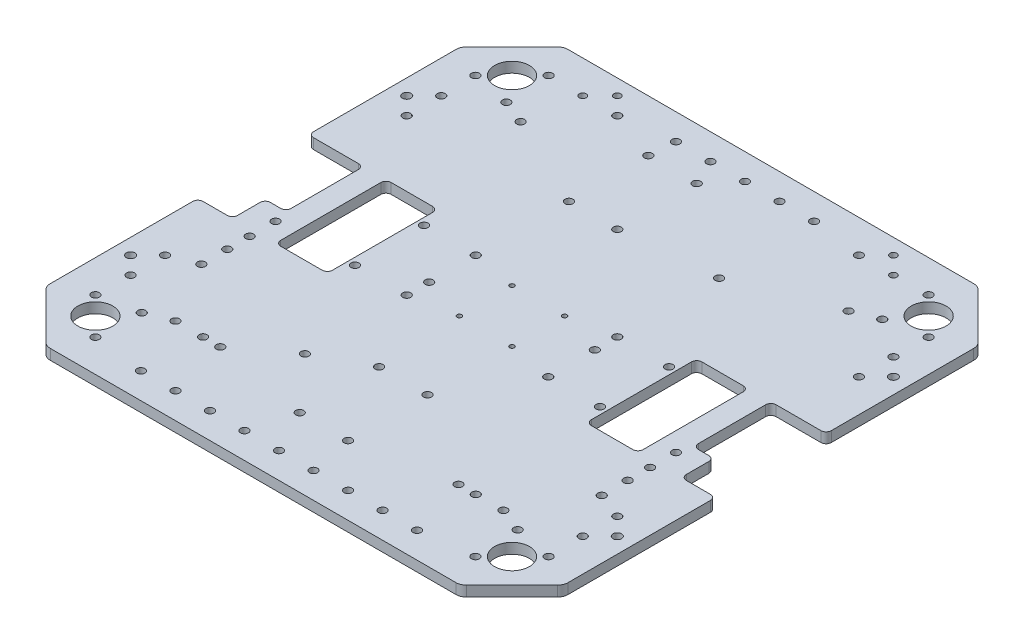
from build123d import *

# Parameters (mm, degrees)
BOSS_EXTRU_1_DEPTH                  = 6
ENL_V_MAT_EXTRU_1_REACH             = 214.217
ESQUISSE2_R                         = 10.1
ESQUISSE2_R_2                       = 2.3
SYM_TRIE2_COPY_1_REACH              = 214.217
SYM_TRIE2_COPY_1_SKETCH_R           = 10.1
SYM_TRIE2_COPY_1_SKETCH_R_2         = 2.3
ENL_V_MAT_EXTRU_2_REACH             = 214.217
ENL_V_MAT_EXTRU_2_DIRECTION_2_DEPTH = 213.216870206
CONG_1_R                            = 3
ENL_V_MAT_EXTRU_3_REACH             = 214.217
CONG_2_R                            = 3
ENL_V_MAT_EXTRU_4_REACH             = 214.217
ESQUISSE5_R                         = 2.3
ENL_V_MAT_EXTRU_5_REACH             = 214.217
ESQUISSE6_R                         = 2.3
ENL_V_MAT_EXTRU_6_REACH             = 214.217
ESQUISSE7_R                         = 2.476946043
ESQUISSE7_R_2                       = 2.3
ENL_V_MAT_EXTRU_7_REACH             = 214.217
ESQUISSE8_R                         = 2.3
ENL_V_MAT_EXTRU_8_REACH             = 214.217
ESQUISSE10_R                        = 2.3
CONG_3_R                            = 6
ENL_V_MAT_EXTRU_9_REACH             = 214.217
ESQUISSE11_R                        = 2.3
ENL_V_MAT_EXTRU_10_REACH            = 214.217
ESQUISSE12_R                        = 2.3
ENL_V_MAT_EXTRU_11_REACH            = 214.217
ESQUISSE13_R                        = 2.3
ENL_V_MAT_EXTRU_12_REACH            = 214.217
ESQUISSE14_R                        = 2.3
ESQUISSE14_R_2                      = 2
ENL_V_MAT_EXTRU_13_REACH            = 214.217
ESQUISSE15_W                        = 15
ESQUISSE15_H                        = 45
CONG_4_R                            = 3
ESQUISSE16_R                        = 1.35
ENL_V_MAT_EXTRU_14_DEPTH            = 10
ESQUISSE17_R                        = 2.3
ENL_V_MAT_EXTRU_16_DEPTH            = 10


with BuildPart() as part:
    # Esquisse1 → Boss.-Extru.1 (new body)
    with BuildSketch(Plane(origin=(0, 0, 0), x_dir=(1, 0, 0), z_dir=(0, 1, 0))):
        Polygon((-150, 0), (-150, 120), (-120, 150), (0, 150), (120, 150), (150, 120), (150, 0), (150, -120), (120, -150), (0, -150), (-120, -150), (-150, -120), align=None)
    extrude(amount=BOSS_EXTRU_1_DEPTH)

    # Esquisse2 → Enlèv. mat.-Extru.1 (cut, up to next)
    with BuildSketch(Plane(origin=(0, 6, 0), x_dir=(1, 0, 0), z_dir=(0, 1, 0)), mode=Mode.PRIVATE) as enl_v_mat_extru_1_sk1:
        with Locations(Location((-120.69746073, 120.69746073, 0), (0, 0, 270))):
            Circle(ESQUISSE2_R)
    enl_v_mat_extru_1_tool1 = extrude(enl_v_mat_extru_1_sk1.sketch, amount=-ENL_V_MAT_EXTRU_1_REACH, mode=Mode.PRIVATE) & part.part
    # Esquisse2 → Enlèv. mat.-Extru.1 (cut, up to next)
    with BuildSketch(Plane(origin=(0, 6, 0), x_dir=(1, 0, 0), z_dir=(0, 1, 0)), mode=Mode.PRIVATE) as enl_v_mat_extru_1_sk2:
        with Locations(Location((-131.304062448, 110.090859012, 0), (0, 0, 270))):
            Circle(ESQUISSE2_R_2)
    enl_v_mat_extru_1_tool2 = extrude(enl_v_mat_extru_1_sk2.sketch, amount=-ENL_V_MAT_EXTRU_1_REACH, mode=Mode.PRIVATE) & part.part
    # Esquisse2 → Enlèv. mat.-Extru.1 (cut, up to next)
    with BuildSketch(Plane(origin=(0, 6, 0), x_dir=(1, 0, 0), z_dir=(0, 1, 0)), mode=Mode.PRIVATE) as enl_v_mat_extru_1_sk3:
        with Locations(Location((-110.090859012, 131.304062448, 0), (0, 0, 270))):
            Circle(ESQUISSE2_R_2)
    enl_v_mat_extru_1_tool3 = extrude(enl_v_mat_extru_1_sk3.sketch, amount=-ENL_V_MAT_EXTRU_1_REACH, mode=Mode.PRIVATE) & part.part
    enl_v_mat_extru_1_1 = enl_v_mat_extru_1_tool1.solids().sort_by_distance((-120.697461, 6, -120.697461))[0]
    add(enl_v_mat_extru_1_1, mode=Mode.SUBTRACT)
    enl_v_mat_extru_1_2 = enl_v_mat_extru_1_tool2.solids().sort_by_distance((-131.304062, 6, -110.090859))[0]
    add(enl_v_mat_extru_1_2, mode=Mode.SUBTRACT)
    enl_v_mat_extru_1_3 = enl_v_mat_extru_1_tool3.solids().sort_by_distance((-110.090859, 6, -131.304062))[0]
    add(enl_v_mat_extru_1_3, mode=Mode.SUBTRACT)
    enl_v_mat_extru_1 = enl_v_mat_extru_1_1 + enl_v_mat_extru_1_2 + enl_v_mat_extru_1_3  # Enlèv. mat.-Extru.1 as one shape, for the pattern or mirror that repeats it

    # Symétrie1: Enlèv. mat.-Extru.1 across plane
    add(enl_v_mat_extru_1.mirror(Plane(origin=(0, 0, 0), x_dir=(0, 0, 1), z_dir=(1, 0, 0))), mode=Mode.SUBTRACT)

    # Symétrie2: Enlèv. mat.-Extru.1 across plane
    add(enl_v_mat_extru_1.mirror(Plane.XY), mode=Mode.SUBTRACT)

    # Symétrie2 copy 1 sketch → Symétrie2 copy 1 (cut, up to next)
    with BuildSketch(Plane(origin=(0, 6, 0), x_dir=(-1, 0, 0), z_dir=(0, 1, 0)), mode=Mode.PRIVATE) as sym_trie2_copy_1_sk1:
        with Locations(Location((-120.69746073, 120.69746073, 0), (0, 0, 270))):
            Circle(SYM_TRIE2_COPY_1_SKETCH_R)
    sym_trie2_copy_1_tool1 = extrude(sym_trie2_copy_1_sk1.sketch, amount=-SYM_TRIE2_COPY_1_REACH, mode=Mode.PRIVATE) & part.part
    # Symétrie2 copy 1 sketch → Symétrie2 copy 1 (cut, up to next)
    with BuildSketch(Plane(origin=(0, 6, 0), x_dir=(-1, 0, 0), z_dir=(0, 1, 0)), mode=Mode.PRIVATE) as sym_trie2_copy_1_sk2:
        with Locations(Location((-131.304062448, 110.090859012, 0), (0, 0, 270))):
            Circle(SYM_TRIE2_COPY_1_SKETCH_R_2)
    sym_trie2_copy_1_tool2 = extrude(sym_trie2_copy_1_sk2.sketch, amount=-SYM_TRIE2_COPY_1_REACH, mode=Mode.PRIVATE) & part.part
    # Symétrie2 copy 1 sketch → Symétrie2 copy 1 (cut, up to next)
    with BuildSketch(Plane(origin=(0, 6, 0), x_dir=(-1, 0, 0), z_dir=(0, 1, 0)), mode=Mode.PRIVATE) as sym_trie2_copy_1_sk3:
        with Locations(Location((-110.090859012, 131.304062448, 0), (0, 0, 270))):
            Circle(SYM_TRIE2_COPY_1_SKETCH_R_2)
    sym_trie2_copy_1_tool3 = extrude(sym_trie2_copy_1_sk3.sketch, amount=-SYM_TRIE2_COPY_1_REACH, mode=Mode.PRIVATE) & part.part
    add(sym_trie2_copy_1_tool1.solids().sort_by_distance((120.697461, 6, 120.697461))[0], mode=Mode.SUBTRACT)
    add(sym_trie2_copy_1_tool2.solids().sort_by_distance((131.304062, 6, 110.090859))[0], mode=Mode.SUBTRACT)
    add(sym_trie2_copy_1_tool3.solids().sort_by_distance((110.090859, 6, 131.304062))[0], mode=Mode.SUBTRACT)

    # Esquisse3 → Enlèv. mat.-Extru.2 (cut, up to next)
    with BuildSketch(Plane(origin=(0, 6, 0), x_dir=(1, 0, 0), z_dir=(0, 1, 0)), mode=Mode.PRIVATE) as enl_v_mat_extru_2_sk1:
        Polygon((-150, 0), (-150, -32), (-130, -32), (-130, 32), (-150, 32), align=None)
    enl_v_mat_extru_2_tool1 = extrude(enl_v_mat_extru_2_sk1.sketch, amount=-ENL_V_MAT_EXTRU_2_REACH, mode=Mode.PRIVATE) & part.part
    enl_v_mat_extru_2 = enl_v_mat_extru_2_tool1.solids().sort_by_distance((-140, 6, 0))[0]
    add(enl_v_mat_extru_2, mode=Mode.SUBTRACT)

    # Esquisse3 → Enlèv. mat.-Extru.2 direction 2 (cut)
    with BuildSketch(Plane(origin=(0, 6, 0), x_dir=(1, 0, 0), z_dir=(0, 1, 0))):
        Polygon((-150, 0), (-150, -32), (-130, -32), (-130, 32), (-150, 32), align=None)
    enl_v_mat_extru_2_direction_2 = extrude(amount=ENL_V_MAT_EXTRU_2_DIRECTION_2_DEPTH, mode=Mode.SUBTRACT)

    # Symétrie3: Enlèv. mat.-Extru.2, Enlèv. mat.-Extru.2 direction 2 across plane
    add(enl_v_mat_extru_2.mirror(Plane(origin=(0, 0, 0), x_dir=(0, 0, 1), z_dir=(1, 0, 0))), mode=Mode.SUBTRACT)
    add(enl_v_mat_extru_2_direction_2.mirror(Plane(origin=(0, 0, 0), x_dir=(0, 0, 1), z_dir=(1, 0, 0))), mode=Mode.SUBTRACT)

    # Congé1
    cong_1_edges = [part.edges().sort_by_distance(p)[0] for p in [
        (150, 3, 32),
        (150, 3, -32),
        (130, 3, -32),
        (130, 3, 32),
        (-150, 3, -32),
        (-150, 3, 32),
        (-130, 3, 32),
        (-130, 3, -32),
    ]]
    fillet(cong_1_edges, radius=CONG_1_R)

    # Esquisse4 → Enlèv. mat.-Extru.3 (cut, up to next)
    with BuildSketch(Plane(origin=(0, 6, 0), x_dir=(1, 0, 0), z_dir=(0, 1, 0)), mode=Mode.PRIVATE) as enl_v_mat_extru_3_sk1:
        Polygon((-105, 0), (-105, 32), (-75, 32), (-75, -32), (-105, -32), align=None)
    enl_v_mat_extru_3_tool1 = extrude(enl_v_mat_extru_3_sk1.sketch, amount=-ENL_V_MAT_EXTRU_3_REACH, mode=Mode.PRIVATE) & part.part
    enl_v_mat_extru_3 = enl_v_mat_extru_3_tool1.solids().sort_by_distance((-90, 6, 0))[0]
    add(enl_v_mat_extru_3, mode=Mode.SUBTRACT)

    # Symétrie4: Enlèv. mat.-Extru.3 across plane
    add(enl_v_mat_extru_3.mirror(Plane(origin=(0, 0, 0), x_dir=(0, 0, 1), z_dir=(1, 0, 0))), mode=Mode.SUBTRACT)

    # Congé2
    cong_2_edges = [part.edges().sort_by_distance(p)[0] for p in [
        (-105, 3, -32),
        (-75, 3, -32),
        (-75, 3, 32),
        (-105, 3, 32),
        (75, 3, -32),
        (105, 3, -32),
        (105, 3, 32),
        (75, 3, 32),
    ]]
    fillet(cong_2_edges, radius=CONG_2_R)

    # Esquisse5 → Enlèv. mat.-Extru.4 (cut, up to next)
    with BuildSketch(Plane(origin=(0, 6, 0), x_dir=(1, 0, 0), z_dir=(0, 1, 0)), mode=Mode.PRIVATE) as enl_v_mat_extru_4_sk1:
        with Locations(Location((-71, 20, 0), (0, 0, 270))):
            Circle(ESQUISSE5_R)
    enl_v_mat_extru_4_tool1 = extrude(enl_v_mat_extru_4_sk1.sketch, amount=-ENL_V_MAT_EXTRU_4_REACH, mode=Mode.PRIVATE) & part.part
    # Esquisse5 → Enlèv. mat.-Extru.4 (cut, up to next)
    with BuildSketch(Plane(origin=(0, 6, 0), x_dir=(1, 0, 0), z_dir=(0, 1, 0)), mode=Mode.PRIVATE) as enl_v_mat_extru_4_sk2:
        with Locations(Location((-71, -20, 0), (0, 0, 270))):
            Circle(ESQUISSE5_R)
    enl_v_mat_extru_4_tool2 = extrude(enl_v_mat_extru_4_sk2.sketch, amount=-ENL_V_MAT_EXTRU_4_REACH, mode=Mode.PRIVATE) & part.part
    enl_v_mat_extru_4_1 = enl_v_mat_extru_4_tool1.solids().sort_by_distance((-71, 6, -20))[0]
    add(enl_v_mat_extru_4_1, mode=Mode.SUBTRACT)
    enl_v_mat_extru_4_2 = enl_v_mat_extru_4_tool2.solids().sort_by_distance((-71, 6, 20))[0]
    add(enl_v_mat_extru_4_2, mode=Mode.SUBTRACT)
    enl_v_mat_extru_4 = enl_v_mat_extru_4_1 + enl_v_mat_extru_4_2  # Enlèv. mat.-Extru.4 as one shape, for the pattern or mirror that repeats it

    # Symétrie5: Enlèv. mat.-Extru.4 across plane
    add(enl_v_mat_extru_4.mirror(Plane(origin=(0, 0, 0), x_dir=(0, 0, 1), z_dir=(1, 0, 0))), mode=Mode.SUBTRACT)

    # Esquisse6 → Enlèv. mat.-Extru.5 (cut, up to next)
    with BuildSketch(Plane(origin=(0, 6, 0), x_dir=(1, 0, 0), z_dir=(0, 1, 0)), mode=Mode.PRIVATE) as enl_v_mat_extru_5_sk1:
        with Locations(Location((-41, -79, 0), (0, 0, 270))):
            Circle(ESQUISSE6_R)
    enl_v_mat_extru_5_tool1 = extrude(enl_v_mat_extru_5_sk1.sketch, amount=-ENL_V_MAT_EXTRU_5_REACH, mode=Mode.PRIVATE) & part.part
    # Esquisse6 → Enlèv. mat.-Extru.5 (cut, up to next)
    with BuildSketch(Plane(origin=(0, 6, 0), x_dir=(1, 0, 0), z_dir=(0, 1, 0)), mode=Mode.PRIVATE) as enl_v_mat_extru_5_sk2:
        with Locations(Location((-41, -20, 0), (0, 0, 270))):
            Circle(ESQUISSE6_R)
    enl_v_mat_extru_5_tool2 = extrude(enl_v_mat_extru_5_sk2.sketch, amount=-ENL_V_MAT_EXTRU_5_REACH, mode=Mode.PRIVATE) & part.part
    # Esquisse6 → Enlèv. mat.-Extru.5 (cut, up to next)
    with BuildSketch(Plane(origin=(0, 6, 0), x_dir=(1, 0, 0), z_dir=(0, 1, 0)), mode=Mode.PRIVATE) as enl_v_mat_extru_5_sk3:
        with Locations(Location((-41, 20, 0), (0, 0, 270))):
            Circle(ESQUISSE6_R)
    enl_v_mat_extru_5_tool3 = extrude(enl_v_mat_extru_5_sk3.sketch, amount=-ENL_V_MAT_EXTRU_5_REACH, mode=Mode.PRIVATE) & part.part
    # Esquisse6 → Enlèv. mat.-Extru.5 (cut, up to next)
    with BuildSketch(Plane(origin=(0, 6, 0), x_dir=(1, 0, 0), z_dir=(0, 1, 0)), mode=Mode.PRIVATE) as enl_v_mat_extru_5_sk4:
        with Locations(Location((41, -20, 0), (0, 0, 270))):
            Circle(ESQUISSE6_R)
    enl_v_mat_extru_5_tool4 = extrude(enl_v_mat_extru_5_sk4.sketch, amount=-ENL_V_MAT_EXTRU_5_REACH, mode=Mode.PRIVATE) & part.part
    # Esquisse6 → Enlèv. mat.-Extru.5 (cut, up to next)
    with BuildSketch(Plane(origin=(0, 6, 0), x_dir=(1, 0, 0), z_dir=(0, 1, 0)), mode=Mode.PRIVATE) as enl_v_mat_extru_5_sk5:
        with Locations(Location((41, 79, 0), (0, 0, 270))):
            Circle(ESQUISSE6_R)
    enl_v_mat_extru_5_tool5 = extrude(enl_v_mat_extru_5_sk5.sketch, amount=-ENL_V_MAT_EXTRU_5_REACH, mode=Mode.PRIVATE) & part.part
    # Esquisse6 → Enlèv. mat.-Extru.5 (cut, up to next)
    with BuildSketch(Plane(origin=(0, 6, 0), x_dir=(1, 0, 0), z_dir=(0, 1, 0)), mode=Mode.PRIVATE) as enl_v_mat_extru_5_sk6:
        with Locations(Location((41, 20, 0), (0, 0, 270))):
            Circle(ESQUISSE6_R)
    enl_v_mat_extru_5_tool6 = extrude(enl_v_mat_extru_5_sk6.sketch, amount=-ENL_V_MAT_EXTRU_5_REACH, mode=Mode.PRIVATE) & part.part
    # Esquisse6 → Enlèv. mat.-Extru.5 (cut, up to next)
    with BuildSketch(Plane(origin=(0, 6, 0), x_dir=(1, 0, 0), z_dir=(0, 1, 0)), mode=Mode.PRIVATE) as enl_v_mat_extru_5_sk7:
        with Locations(Location((41, 7, 0), (0, 0, 270))):
            Circle(ESQUISSE6_R)
    enl_v_mat_extru_5_tool7 = extrude(enl_v_mat_extru_5_sk7.sketch, amount=-ENL_V_MAT_EXTRU_5_REACH, mode=Mode.PRIVATE) & part.part
    # Esquisse6 → Enlèv. mat.-Extru.5 (cut, up to next)
    with BuildSketch(Plane(origin=(0, 6, 0), x_dir=(1, 0, 0), z_dir=(0, 1, 0)), mode=Mode.PRIVATE) as enl_v_mat_extru_5_sk8:
        with Locations(Location((-41, -7, 0), (0, 0, 270))):
            Circle(ESQUISSE6_R)
    enl_v_mat_extru_5_tool8 = extrude(enl_v_mat_extru_5_sk8.sketch, amount=-ENL_V_MAT_EXTRU_5_REACH, mode=Mode.PRIVATE) & part.part
    add(enl_v_mat_extru_5_tool1.solids().sort_by_distance((-41, 6, 79))[0], mode=Mode.SUBTRACT)
    add(enl_v_mat_extru_5_tool2.solids().sort_by_distance((-41, 6, 20))[0], mode=Mode.SUBTRACT)
    add(enl_v_mat_extru_5_tool3.solids().sort_by_distance((-41, 6, -20))[0], mode=Mode.SUBTRACT)
    add(enl_v_mat_extru_5_tool4.solids().sort_by_distance((41, 6, 20))[0], mode=Mode.SUBTRACT)
    add(enl_v_mat_extru_5_tool5.solids().sort_by_distance((41, 6, -79))[0], mode=Mode.SUBTRACT)
    add(enl_v_mat_extru_5_tool6.solids().sort_by_distance((41, 6, -20))[0], mode=Mode.SUBTRACT)
    add(enl_v_mat_extru_5_tool7.solids().sort_by_distance((41, 6, -7))[0], mode=Mode.SUBTRACT)
    add(enl_v_mat_extru_5_tool8.solids().sort_by_distance((-41, 6, 7))[0], mode=Mode.SUBTRACT)

    # Esquisse7 → Enlèv. mat.-Extru.6 (cut, up to next)
    with BuildSketch(Plane(origin=(0, 6, 0), x_dir=(1, 0, 0), z_dir=(0, 1, 0)), mode=Mode.PRIVATE) as enl_v_mat_extru_6_sk1:
        with Locations(Location((141, -80, 0), (0, 0, 270))):
            Circle(ESQUISSE7_R)
    enl_v_mat_extru_6_tool1 = extrude(enl_v_mat_extru_6_sk1.sketch, amount=-ENL_V_MAT_EXTRU_6_REACH, mode=Mode.PRIVATE) & part.part
    # Esquisse7 → Enlèv. mat.-Extru.6 (cut, up to next)
    with BuildSketch(Plane(origin=(0, 6, 0), x_dir=(1, 0, 0), z_dir=(0, 1, 0)), mode=Mode.PRIVATE) as enl_v_mat_extru_6_sk2:
        with Locations(Location((131, -90, 0), (0, 0, 270))):
            Circle(ESQUISSE7_R_2)
    enl_v_mat_extru_6_tool2 = extrude(enl_v_mat_extru_6_sk2.sketch, amount=-ENL_V_MAT_EXTRU_6_REACH, mode=Mode.PRIVATE) & part.part
    # Esquisse7 → Enlèv. mat.-Extru.6 (cut, up to next)
    with BuildSketch(Plane(origin=(0, 6, 0), x_dir=(1, 0, 0), z_dir=(0, 1, 0)), mode=Mode.PRIVATE) as enl_v_mat_extru_6_sk3:
        with Locations(Location((131, -70, 0), (0, 0, 270))):
            Circle(ESQUISSE7_R_2)
    enl_v_mat_extru_6_tool3 = extrude(enl_v_mat_extru_6_sk3.sketch, amount=-ENL_V_MAT_EXTRU_6_REACH, mode=Mode.PRIVATE) & part.part
    # Esquisse7 → Enlèv. mat.-Extru.6 (cut, up to next)
    with BuildSketch(Plane(origin=(0, 6, 0), x_dir=(1, 0, 0), z_dir=(0, 1, 0)), mode=Mode.PRIVATE) as enl_v_mat_extru_6_sk4:
        with Locations(Location((131, 70, 0), (0, 0, 270))):
            Circle(ESQUISSE7_R_2)
    enl_v_mat_extru_6_tool4 = extrude(enl_v_mat_extru_6_sk4.sketch, amount=-ENL_V_MAT_EXTRU_6_REACH, mode=Mode.PRIVATE) & part.part
    # Esquisse7 → Enlèv. mat.-Extru.6 (cut, up to next)
    with BuildSketch(Plane(origin=(0, 6, 0), x_dir=(1, 0, 0), z_dir=(0, 1, 0)), mode=Mode.PRIVATE) as enl_v_mat_extru_6_sk5:
        with Locations(Location((131, 90, 0), (0, 0, 270))):
            Circle(ESQUISSE7_R_2)
    enl_v_mat_extru_6_tool5 = extrude(enl_v_mat_extru_6_sk5.sketch, amount=-ENL_V_MAT_EXTRU_6_REACH, mode=Mode.PRIVATE) & part.part
    # Esquisse7 → Enlèv. mat.-Extru.6 (cut, up to next)
    with BuildSketch(Plane(origin=(0, 6, 0), x_dir=(1, 0, 0), z_dir=(0, 1, 0)), mode=Mode.PRIVATE) as enl_v_mat_extru_6_sk6:
        with Locations(Location((141, 80, 0), (0, 0, 270))):
            Circle(ESQUISSE7_R)
    enl_v_mat_extru_6_tool6 = extrude(enl_v_mat_extru_6_sk6.sketch, amount=-ENL_V_MAT_EXTRU_6_REACH, mode=Mode.PRIVATE) & part.part
    enl_v_mat_extru_6_1 = enl_v_mat_extru_6_tool1.solids().sort_by_distance((141, 6, 80))[0]
    add(enl_v_mat_extru_6_1, mode=Mode.SUBTRACT)
    enl_v_mat_extru_6_2 = enl_v_mat_extru_6_tool2.solids().sort_by_distance((131, 6, 90))[0]
    add(enl_v_mat_extru_6_2, mode=Mode.SUBTRACT)
    enl_v_mat_extru_6_3 = enl_v_mat_extru_6_tool3.solids().sort_by_distance((131, 6, 70))[0]
    add(enl_v_mat_extru_6_3, mode=Mode.SUBTRACT)
    enl_v_mat_extru_6_4 = enl_v_mat_extru_6_tool4.solids().sort_by_distance((131, 6, -70))[0]
    add(enl_v_mat_extru_6_4, mode=Mode.SUBTRACT)
    enl_v_mat_extru_6_5 = enl_v_mat_extru_6_tool5.solids().sort_by_distance((131, 6, -90))[0]
    add(enl_v_mat_extru_6_5, mode=Mode.SUBTRACT)
    enl_v_mat_extru_6_6 = enl_v_mat_extru_6_tool6.solids().sort_by_distance((141, 6, -80))[0]
    add(enl_v_mat_extru_6_6, mode=Mode.SUBTRACT)
    enl_v_mat_extru_6 = enl_v_mat_extru_6_1 + enl_v_mat_extru_6_2 + enl_v_mat_extru_6_3 + enl_v_mat_extru_6_4 + enl_v_mat_extru_6_5 + enl_v_mat_extru_6_6  # Enlèv. mat.-Extru.6 as one shape, for the pattern or mirror that repeats it

    # Symétrie6: Enlèv. mat.-Extru.6 across plane
    add(enl_v_mat_extru_6.mirror(Plane(origin=(0, 0, 0), x_dir=(0, 0, 1), z_dir=(1, 0, 0))), mode=Mode.SUBTRACT)

    # Esquisse8 → Enlèv. mat.-Extru.7 (cut, up to next)
    with BuildSketch(Plane(origin=(0, 6, 0), x_dir=(1, 0, 0), z_dir=(0, 1, 0)), mode=Mode.PRIVATE) as enl_v_mat_extru_7_sk1:
        with Locations(Location((-80, -135, 0), (0, 0, 270))):
            Circle(ESQUISSE8_R)
    enl_v_mat_extru_7_tool1 = extrude(enl_v_mat_extru_7_sk1.sketch, amount=-ENL_V_MAT_EXTRU_7_REACH, mode=Mode.PRIVATE) & part.part
    # Esquisse8 → Enlèv. mat.-Extru.7 (cut, up to next)
    with BuildSketch(Plane(origin=(0, 6, 0), x_dir=(1, 0, 0), z_dir=(0, 1, 0)), mode=Mode.PRIVATE) as enl_v_mat_extru_7_sk2:
        with Locations(Location((80, -135, 0), (0, 0, 270))):
            Circle(ESQUISSE8_R)
    enl_v_mat_extru_7_tool2 = extrude(enl_v_mat_extru_7_sk2.sketch, amount=-ENL_V_MAT_EXTRU_7_REACH, mode=Mode.PRIVATE) & part.part
    # Esquisse8 → Enlèv. mat.-Extru.7 (cut, up to next)
    with BuildSketch(Plane(origin=(0, 6, 0), x_dir=(1, 0, 0), z_dir=(0, 1, 0)), mode=Mode.PRIVATE) as enl_v_mat_extru_7_sk3:
        with Locations(Location((-60, -135, 0), (0, 0, 270))):
            Circle(ESQUISSE8_R)
    enl_v_mat_extru_7_tool3 = extrude(enl_v_mat_extru_7_sk3.sketch, amount=-ENL_V_MAT_EXTRU_7_REACH, mode=Mode.PRIVATE) & part.part
    # Esquisse8 → Enlèv. mat.-Extru.7 (cut, up to next)
    with BuildSketch(Plane(origin=(0, 6, 0), x_dir=(1, 0, 0), z_dir=(0, 1, 0)), mode=Mode.PRIVATE) as enl_v_mat_extru_7_sk4:
        with Locations(Location((-40, -135, 0), (0, 0, 270))):
            Circle(ESQUISSE8_R)
    enl_v_mat_extru_7_tool4 = extrude(enl_v_mat_extru_7_sk4.sketch, amount=-ENL_V_MAT_EXTRU_7_REACH, mode=Mode.PRIVATE) & part.part
    # Esquisse8 → Enlèv. mat.-Extru.7 (cut, up to next)
    with BuildSketch(Plane(origin=(0, 6, 0), x_dir=(1, 0, 0), z_dir=(0, 1, 0)), mode=Mode.PRIVATE) as enl_v_mat_extru_7_sk5:
        with Locations(Location((-20, -135, 0), (0, 0, 270))):
            Circle(ESQUISSE8_R)
    enl_v_mat_extru_7_tool5 = extrude(enl_v_mat_extru_7_sk5.sketch, amount=-ENL_V_MAT_EXTRU_7_REACH, mode=Mode.PRIVATE) & part.part
    # Esquisse8 → Enlèv. mat.-Extru.7 (cut, up to next)
    with BuildSketch(Plane(origin=(0, 6, 0), x_dir=(1, 0, 0), z_dir=(0, 1, 0)), mode=Mode.PRIVATE) as enl_v_mat_extru_7_sk6:
        with Locations(Location((0, -135, 0), (0, 0, 270))):
            Circle(ESQUISSE8_R)
    enl_v_mat_extru_7_tool6 = extrude(enl_v_mat_extru_7_sk6.sketch, amount=-ENL_V_MAT_EXTRU_7_REACH, mode=Mode.PRIVATE) & part.part
    # Esquisse8 → Enlèv. mat.-Extru.7 (cut, up to next)
    with BuildSketch(Plane(origin=(0, 6, 0), x_dir=(1, 0, 0), z_dir=(0, 1, 0)), mode=Mode.PRIVATE) as enl_v_mat_extru_7_sk7:
        with Locations(Location((20, -135, 0), (0, 0, 270))):
            Circle(ESQUISSE8_R)
    enl_v_mat_extru_7_tool7 = extrude(enl_v_mat_extru_7_sk7.sketch, amount=-ENL_V_MAT_EXTRU_7_REACH, mode=Mode.PRIVATE) & part.part
    # Esquisse8 → Enlèv. mat.-Extru.7 (cut, up to next)
    with BuildSketch(Plane(origin=(0, 6, 0), x_dir=(1, 0, 0), z_dir=(0, 1, 0)), mode=Mode.PRIVATE) as enl_v_mat_extru_7_sk8:
        with Locations(Location((40, -135, 0), (0, 0, 270))):
            Circle(ESQUISSE8_R)
    enl_v_mat_extru_7_tool8 = extrude(enl_v_mat_extru_7_sk8.sketch, amount=-ENL_V_MAT_EXTRU_7_REACH, mode=Mode.PRIVATE) & part.part
    # Esquisse8 → Enlèv. mat.-Extru.7 (cut, up to next)
    with BuildSketch(Plane(origin=(0, 6, 0), x_dir=(1, 0, 0), z_dir=(0, 1, 0)), mode=Mode.PRIVATE) as enl_v_mat_extru_7_sk9:
        with Locations(Location((60, -135, 0), (0, 0, 270))):
            Circle(ESQUISSE8_R)
    enl_v_mat_extru_7_tool9 = extrude(enl_v_mat_extru_7_sk9.sketch, amount=-ENL_V_MAT_EXTRU_7_REACH, mode=Mode.PRIVATE) & part.part
    # Esquisse8 → Enlèv. mat.-Extru.7 (cut, up to next)
    with BuildSketch(Plane(origin=(0, 6, 0), x_dir=(1, 0, 0), z_dir=(0, 1, 0)), mode=Mode.PRIVATE) as enl_v_mat_extru_7_sk10:
        with Locations(Location((40, 135, 0), (0, 0, 270))):
            Circle(ESQUISSE8_R)
    enl_v_mat_extru_7_tool10 = extrude(enl_v_mat_extru_7_sk10.sketch, amount=-ENL_V_MAT_EXTRU_7_REACH, mode=Mode.PRIVATE) & part.part
    # Esquisse8 → Enlèv. mat.-Extru.7 (cut, up to next)
    with BuildSketch(Plane(origin=(0, 6, 0), x_dir=(1, 0, 0), z_dir=(0, 1, 0)), mode=Mode.PRIVATE) as enl_v_mat_extru_7_sk11:
        with Locations(Location((20, 135, 0), (0, 0, 270))):
            Circle(ESQUISSE8_R)
    enl_v_mat_extru_7_tool11 = extrude(enl_v_mat_extru_7_sk11.sketch, amount=-ENL_V_MAT_EXTRU_7_REACH, mode=Mode.PRIVATE) & part.part
    # Esquisse8 → Enlèv. mat.-Extru.7 (cut, up to next)
    with BuildSketch(Plane(origin=(0, 6, 0), x_dir=(1, 0, 0), z_dir=(0, 1, 0)), mode=Mode.PRIVATE) as enl_v_mat_extru_7_sk12:
        with Locations(Location((0, 135, 0), (0, 0, 270))):
            Circle(ESQUISSE8_R)
    enl_v_mat_extru_7_tool12 = extrude(enl_v_mat_extru_7_sk12.sketch, amount=-ENL_V_MAT_EXTRU_7_REACH, mode=Mode.PRIVATE) & part.part
    # Esquisse8 → Enlèv. mat.-Extru.7 (cut, up to next)
    with BuildSketch(Plane(origin=(0, 6, 0), x_dir=(1, 0, 0), z_dir=(0, 1, 0)), mode=Mode.PRIVATE) as enl_v_mat_extru_7_sk13:
        with Locations(Location((-20, 135, 0), (0, 0, 270))):
            Circle(ESQUISSE8_R)
    enl_v_mat_extru_7_tool13 = extrude(enl_v_mat_extru_7_sk13.sketch, amount=-ENL_V_MAT_EXTRU_7_REACH, mode=Mode.PRIVATE) & part.part
    # Esquisse8 → Enlèv. mat.-Extru.7 (cut, up to next)
    with BuildSketch(Plane(origin=(0, 6, 0), x_dir=(1, 0, 0), z_dir=(0, 1, 0)), mode=Mode.PRIVATE) as enl_v_mat_extru_7_sk14:
        with Locations(Location((-40, 135, 0), (0, 0, 270))):
            Circle(ESQUISSE8_R)
    enl_v_mat_extru_7_tool14 = extrude(enl_v_mat_extru_7_sk14.sketch, amount=-ENL_V_MAT_EXTRU_7_REACH, mode=Mode.PRIVATE) & part.part
    add(enl_v_mat_extru_7_tool1.solids().sort_by_distance((-80, 6, 135))[0], mode=Mode.SUBTRACT)
    add(enl_v_mat_extru_7_tool2.solids().sort_by_distance((80, 6, 135))[0], mode=Mode.SUBTRACT)
    add(enl_v_mat_extru_7_tool3.solids().sort_by_distance((-60, 6, 135))[0], mode=Mode.SUBTRACT)
    add(enl_v_mat_extru_7_tool4.solids().sort_by_distance((-40, 6, 135))[0], mode=Mode.SUBTRACT)
    add(enl_v_mat_extru_7_tool5.solids().sort_by_distance((-20, 6, 135))[0], mode=Mode.SUBTRACT)
    add(enl_v_mat_extru_7_tool6.solids().sort_by_distance((0, 6, 135))[0], mode=Mode.SUBTRACT)
    add(enl_v_mat_extru_7_tool7.solids().sort_by_distance((20, 6, 135))[0], mode=Mode.SUBTRACT)
    add(enl_v_mat_extru_7_tool8.solids().sort_by_distance((40, 6, 135))[0], mode=Mode.SUBTRACT)
    add(enl_v_mat_extru_7_tool9.solids().sort_by_distance((60, 6, 135))[0], mode=Mode.SUBTRACT)
    add(enl_v_mat_extru_7_tool10.solids().sort_by_distance((40, 6, -135))[0], mode=Mode.SUBTRACT)
    add(enl_v_mat_extru_7_tool11.solids().sort_by_distance((20, 6, -135))[0], mode=Mode.SUBTRACT)
    add(enl_v_mat_extru_7_tool12.solids().sort_by_distance((0, 6, -135))[0], mode=Mode.SUBTRACT)
    add(enl_v_mat_extru_7_tool13.solids().sort_by_distance((-20, 6, -135))[0], mode=Mode.SUBTRACT)
    add(enl_v_mat_extru_7_tool14.solids().sort_by_distance((-40, 6, -135))[0], mode=Mode.SUBTRACT)

    # Esquisse10 → Enlèv. mat.-Extru.8 (cut, up to next)
    with BuildSketch(Plane(origin=(0, 6, 0), x_dir=(1, 0, 0), z_dir=(0, 1, 0)), mode=Mode.PRIVATE) as enl_v_mat_extru_8_sk1:
        with Locations(Location((-116, -36, 0), (0, 0, 270))):
            Circle(ESQUISSE10_R)
    enl_v_mat_extru_8_tool1 = extrude(enl_v_mat_extru_8_sk1.sketch, amount=-ENL_V_MAT_EXTRU_8_REACH, mode=Mode.PRIVATE) & part.part
    # Esquisse10 → Enlèv. mat.-Extru.8 (cut, up to next)
    with BuildSketch(Plane(origin=(0, 6, 0), x_dir=(1, 0, 0), z_dir=(0, 1, 0)), mode=Mode.PRIVATE) as enl_v_mat_extru_8_sk2:
        with Locations(Location((-116, -64, 0), (0, 0, 270))):
            Circle(ESQUISSE10_R)
    enl_v_mat_extru_8_tool2 = extrude(enl_v_mat_extru_8_sk2.sketch, amount=-ENL_V_MAT_EXTRU_8_REACH, mode=Mode.PRIVATE) & part.part
    enl_v_mat_extru_8_1 = enl_v_mat_extru_8_tool1.solids().sort_by_distance((-116, 6, 36))[0]
    add(enl_v_mat_extru_8_1, mode=Mode.SUBTRACT)
    enl_v_mat_extru_8_2 = enl_v_mat_extru_8_tool2.solids().sort_by_distance((-116, 6, 64))[0]
    add(enl_v_mat_extru_8_2, mode=Mode.SUBTRACT)
    enl_v_mat_extru_8 = enl_v_mat_extru_8_1 + enl_v_mat_extru_8_2  # Enlèv. mat.-Extru.8 as one shape, for the pattern or mirror that repeats it

    # Symétrie8: Enlèv. mat.-Extru.8 across plane
    add(enl_v_mat_extru_8.mirror(Plane(origin=(0, 0, 0), x_dir=(0, 0, 1), z_dir=(1, 0, 0))), mode=Mode.SUBTRACT)

    # Congé3
    cong_3_edges = [part.edges().sort_by_distance(p)[0] for p in [
        (-150, 3, -120),
        (-120, 3, -150),
        (120, 3, -150),
        (150, 3, -120),
        (150, 3, 120),
        (120, 3, 150),
        (-120, 3, 150),
        (-150, 3, 120),
    ]]
    fillet(cong_3_edges, radius=CONG_3_R)

    # Esquisse11 → Enlèv. mat.-Extru.9 (cut, up to next)
    with BuildSketch(Plane(origin=(0, 6, 0), x_dir=(1, 0, 0), z_dir=(0, 1, 0)), mode=Mode.PRIVATE) as enl_v_mat_extru_9_sk1:
        with Locations(Location((-116, -21, 0), (0, 0, 270))):
            Circle(ESQUISSE11_R)
    enl_v_mat_extru_9_tool1 = extrude(enl_v_mat_extru_9_sk1.sketch, amount=-ENL_V_MAT_EXTRU_9_REACH, mode=Mode.PRIVATE) & part.part
    # Esquisse11 → Enlèv. mat.-Extru.9 (cut, up to next)
    with BuildSketch(Plane(origin=(0, 6, 0), x_dir=(1, 0, 0), z_dir=(0, 1, 0)), mode=Mode.PRIVATE) as enl_v_mat_extru_9_sk2:
        with Locations(Location((-116, -49, 0), (0, 0, 270))):
            Circle(ESQUISSE11_R)
    enl_v_mat_extru_9_tool2 = extrude(enl_v_mat_extru_9_sk2.sketch, amount=-ENL_V_MAT_EXTRU_9_REACH, mode=Mode.PRIVATE) & part.part
    # Esquisse11 → Enlèv. mat.-Extru.9 (cut, up to next)
    with BuildSketch(Plane(origin=(0, 6, 0), x_dir=(1, 0, 0), z_dir=(0, 1, 0)), mode=Mode.PRIVATE) as enl_v_mat_extru_9_sk3:
        with Locations(Location((116, -49, 0), (0, 0, 270))):
            Circle(ESQUISSE11_R)
    enl_v_mat_extru_9_tool3 = extrude(enl_v_mat_extru_9_sk3.sketch, amount=-ENL_V_MAT_EXTRU_9_REACH, mode=Mode.PRIVATE) & part.part
    # Esquisse11 → Enlèv. mat.-Extru.9 (cut, up to next)
    with BuildSketch(Plane(origin=(0, 6, 0), x_dir=(1, 0, 0), z_dir=(0, 1, 0)), mode=Mode.PRIVATE) as enl_v_mat_extru_9_sk4:
        with Locations(Location((116, -21, 0), (0, 0, 270))):
            Circle(ESQUISSE11_R)
    enl_v_mat_extru_9_tool4 = extrude(enl_v_mat_extru_9_sk4.sketch, amount=-ENL_V_MAT_EXTRU_9_REACH, mode=Mode.PRIVATE) & part.part
    add(enl_v_mat_extru_9_tool1.solids().sort_by_distance((-116, 6, 21))[0], mode=Mode.SUBTRACT)
    add(enl_v_mat_extru_9_tool2.solids().sort_by_distance((-116, 6, 49))[0], mode=Mode.SUBTRACT)
    add(enl_v_mat_extru_9_tool3.solids().sort_by_distance((116, 6, 49))[0], mode=Mode.SUBTRACT)
    add(enl_v_mat_extru_9_tool4.solids().sort_by_distance((116, 6, 21))[0], mode=Mode.SUBTRACT)

    # Esquisse12 → Enlèv. mat.-Extru.10 (cut, up to next)
    with BuildSketch(Plane(origin=(0, 6, 0), x_dir=(1, 0, 0), z_dir=(0, 1, 0)), mode=Mode.PRIVATE) as enl_v_mat_extru_10_sk1:
        with Locations(Location((-95, -100, 0), (0, 0, 270))):
            Circle(ESQUISSE12_R)
    enl_v_mat_extru_10_tool1 = extrude(enl_v_mat_extru_10_sk1.sketch, amount=-ENL_V_MAT_EXTRU_10_REACH, mode=Mode.PRIVATE) & part.part
    # Esquisse12 → Enlèv. mat.-Extru.10 (cut, up to next)
    with BuildSketch(Plane(origin=(0, 6, 0), x_dir=(1, 0, 0), z_dir=(0, 1, 0)), mode=Mode.PRIVATE) as enl_v_mat_extru_10_sk2:
        with Locations(Location((-108.907757819, -105.619098901, 0), (0, 0, 270))):
            Circle(ESQUISSE12_R)
    enl_v_mat_extru_10_tool2 = extrude(enl_v_mat_extru_10_sk2.sketch, amount=-ENL_V_MAT_EXTRU_10_REACH, mode=Mode.PRIVATE) & part.part
    # Esquisse12 → Enlèv. mat.-Extru.10 (cut, up to next)
    with BuildSketch(Plane(origin=(0, 6, 0), x_dir=(1, 0, 0), z_dir=(0, 1, 0)), mode=Mode.PRIVATE) as enl_v_mat_extru_10_sk3:
        with Locations(Location((108.907757819, -105.619098901, 0), (0, 0, 270))):
            Circle(ESQUISSE12_R)
    enl_v_mat_extru_10_tool3 = extrude(enl_v_mat_extru_10_sk3.sketch, amount=-ENL_V_MAT_EXTRU_10_REACH, mode=Mode.PRIVATE) & part.part
    # Esquisse12 → Enlèv. mat.-Extru.10 (cut, up to next)
    with BuildSketch(Plane(origin=(0, 6, 0), x_dir=(1, 0, 0), z_dir=(0, 1, 0)), mode=Mode.PRIVATE) as enl_v_mat_extru_10_sk4:
        with Locations(Location((95, -100, 0), (0, 0, 270))):
            Circle(ESQUISSE12_R)
    enl_v_mat_extru_10_tool4 = extrude(enl_v_mat_extru_10_sk4.sketch, amount=-ENL_V_MAT_EXTRU_10_REACH, mode=Mode.PRIVATE) & part.part
    enl_v_mat_extru_10_1 = enl_v_mat_extru_10_tool1.solids().sort_by_distance((-95, 6, 100))[0]
    add(enl_v_mat_extru_10_1, mode=Mode.SUBTRACT)
    enl_v_mat_extru_10_2 = enl_v_mat_extru_10_tool2.solids().sort_by_distance((-108.907758, 6, 105.619099))[0]
    add(enl_v_mat_extru_10_2, mode=Mode.SUBTRACT)
    enl_v_mat_extru_10_3 = enl_v_mat_extru_10_tool3.solids().sort_by_distance((108.907758, 6, 105.619099))[0]
    add(enl_v_mat_extru_10_3, mode=Mode.SUBTRACT)
    enl_v_mat_extru_10_4 = enl_v_mat_extru_10_tool4.solids().sort_by_distance((95, 6, 100))[0]
    add(enl_v_mat_extru_10_4, mode=Mode.SUBTRACT)
    enl_v_mat_extru_10 = enl_v_mat_extru_10_1 + enl_v_mat_extru_10_2 + enl_v_mat_extru_10_3 + enl_v_mat_extru_10_4  # Enlèv. mat.-Extru.10 as one shape, for the pattern or mirror that repeats it

    # Symétrie9: Enlèv. mat.-Extru.10 across plane
    add(enl_v_mat_extru_10.mirror(Plane.XY), mode=Mode.SUBTRACT)

    # Esquisse13 → Enlèv. mat.-Extru.11 (cut, up to next)
    with BuildSketch(Plane(origin=(0, 6, 0), x_dir=(1, 0, 0), z_dir=(0, 1, 0)), mode=Mode.PRIVATE) as enl_v_mat_extru_11_sk1:
        with Locations(Location((-79, -100, 0), (0, 0, 270))):
            Circle(ESQUISSE13_R)
    enl_v_mat_extru_11_tool1 = extrude(enl_v_mat_extru_11_sk1.sketch, amount=-ENL_V_MAT_EXTRU_11_REACH, mode=Mode.PRIVATE) & part.part
    # Esquisse13 → Enlèv. mat.-Extru.11 (cut, up to next)
    with BuildSketch(Plane(origin=(0, 6, 0), x_dir=(1, 0, 0), z_dir=(0, 1, 0)), mode=Mode.PRIVATE) as enl_v_mat_extru_11_sk2:
        with Locations(Location((-69, -100, 0), (0, 0, 270))):
            Circle(ESQUISSE13_R)
    enl_v_mat_extru_11_tool2 = extrude(enl_v_mat_extru_11_sk2.sketch, amount=-ENL_V_MAT_EXTRU_11_REACH, mode=Mode.PRIVATE) & part.part
    # Esquisse13 → Enlèv. mat.-Extru.11 (cut, up to next)
    with BuildSketch(Plane(origin=(0, 6, 0), x_dir=(1, 0, 0), z_dir=(0, 1, 0)), mode=Mode.PRIVATE) as enl_v_mat_extru_11_sk3:
        with Locations(Location((69, -100, 0), (0, 0, 270))):
            Circle(ESQUISSE13_R)
    enl_v_mat_extru_11_tool3 = extrude(enl_v_mat_extru_11_sk3.sketch, amount=-ENL_V_MAT_EXTRU_11_REACH, mode=Mode.PRIVATE) & part.part
    # Esquisse13 → Enlèv. mat.-Extru.11 (cut, up to next)
    with BuildSketch(Plane(origin=(0, 6, 0), x_dir=(1, 0, 0), z_dir=(0, 1, 0)), mode=Mode.PRIVATE) as enl_v_mat_extru_11_sk4:
        with Locations(Location((79, -100, 0), (0, 0, 270))):
            Circle(ESQUISSE13_R)
    enl_v_mat_extru_11_tool4 = extrude(enl_v_mat_extru_11_sk4.sketch, amount=-ENL_V_MAT_EXTRU_11_REACH, mode=Mode.PRIVATE) & part.part
    add(enl_v_mat_extru_11_tool1.solids().sort_by_distance((-79, 6, 100))[0], mode=Mode.SUBTRACT)
    add(enl_v_mat_extru_11_tool2.solids().sort_by_distance((-69, 6, 100))[0], mode=Mode.SUBTRACT)
    add(enl_v_mat_extru_11_tool3.solids().sort_by_distance((69, 6, 100))[0], mode=Mode.SUBTRACT)
    add(enl_v_mat_extru_11_tool4.solids().sort_by_distance((79, 6, 100))[0], mode=Mode.SUBTRACT)

    # Esquisse14 → Enlèv. mat.-Extru.12 (cut, up to next)
    with BuildSketch(Plane(origin=(0, 6, 0), x_dir=(1, 0, 0), z_dir=(0, 1, 0)), mode=Mode.PRIVATE) as enl_v_mat_extru_12_sk1:
        with Locations(Location((70, 131, 0), (0, 0, 270))):
            Circle(ESQUISSE14_R)
    enl_v_mat_extru_12_tool1 = extrude(enl_v_mat_extru_12_sk1.sketch, amount=-ENL_V_MAT_EXTRU_12_REACH, mode=Mode.PRIVATE) & part.part
    # Esquisse14 → Enlèv. mat.-Extru.12 (cut, up to next)
    with BuildSketch(Plane(origin=(0, 6, 0), x_dir=(1, 0, 0), z_dir=(0, 1, 0)), mode=Mode.PRIVATE) as enl_v_mat_extru_12_sk2:
        with Locations(Location((90, 131, 0), (0, 0, 270))):
            Circle(ESQUISSE14_R_2)
    enl_v_mat_extru_12_tool2 = extrude(enl_v_mat_extru_12_sk2.sketch, amount=-ENL_V_MAT_EXTRU_12_REACH, mode=Mode.PRIVATE) & part.part
    # Esquisse14 → Enlèv. mat.-Extru.12 (cut, up to next)
    with BuildSketch(Plane(origin=(0, 6, 0), x_dir=(1, 0, 0), z_dir=(0, 1, 0)), mode=Mode.PRIVATE) as enl_v_mat_extru_12_sk3:
        with Locations(Location((80, 141, 0), (0, 0, 270))):
            Circle(ESQUISSE14_R_2)
    enl_v_mat_extru_12_tool3 = extrude(enl_v_mat_extru_12_sk3.sketch, amount=-ENL_V_MAT_EXTRU_12_REACH, mode=Mode.PRIVATE) & part.part
    enl_v_mat_extru_12_1 = enl_v_mat_extru_12_tool1.solids().sort_by_distance((70, 6, -131))[0]
    add(enl_v_mat_extru_12_1, mode=Mode.SUBTRACT)
    enl_v_mat_extru_12_2 = enl_v_mat_extru_12_tool2.solids().sort_by_distance((90, 6, -131))[0]
    add(enl_v_mat_extru_12_2, mode=Mode.SUBTRACT)
    enl_v_mat_extru_12_3 = enl_v_mat_extru_12_tool3.solids().sort_by_distance((80, 6, -141))[0]
    add(enl_v_mat_extru_12_3, mode=Mode.SUBTRACT)
    enl_v_mat_extru_12 = enl_v_mat_extru_12_1 + enl_v_mat_extru_12_2 + enl_v_mat_extru_12_3  # Enlèv. mat.-Extru.12 as one shape, for the pattern or mirror that repeats it

    # Symétrie10: Enlèv. mat.-Extru.12 across plane
    add(enl_v_mat_extru_12.mirror(Plane(origin=(0, 0, 0), x_dir=(0, 0, 1), z_dir=(1, 0, 0))), mode=Mode.SUBTRACT)

    # Esquisse15 → Enlèv. mat.-Extru.13 (cut, up to next)
    with BuildSketch(Plane(origin=(0, 6, 0), x_dir=(1, 0, 0), z_dir=(0, 1, 0)), mode=Mode.PRIVATE) as enl_v_mat_extru_13_sk1:
        with Locations((-125.5, 9.5)):
            Rectangle(ESQUISSE15_W, ESQUISSE15_H)
    enl_v_mat_extru_13_tool1 = extrude(enl_v_mat_extru_13_sk1.sketch, amount=-ENL_V_MAT_EXTRU_13_REACH, mode=Mode.PRIVATE) & part.part
    enl_v_mat_extru_13 = enl_v_mat_extru_13_tool1.solids().sort_by_distance((-125.5, 6, -9.5))[0]
    add(enl_v_mat_extru_13, mode=Mode.SUBTRACT)

    # Symétrie11: Enlèv. mat.-Extru.13 across plane
    add(enl_v_mat_extru_13.mirror(Plane(origin=(0, 0, 0), x_dir=(0, 0, 1), z_dir=(1, 0, 0))), mode=Mode.SUBTRACT)

    # Congé4
    cong_4_edges = [part.edges().sort_by_distance(p)[0] for p in [
        (-118, 3, -32),
        (-130, 3, 13),
        (-118, 3, 13),
        (130, 3, 13),
        (118, 3, 13),
        (118, 3, -32),
    ]]
    fillet(cong_4_edges, radius=CONG_4_R)

    # Esquisse16 → Enlèv. mat.-Extru.14 (cut)
    with BuildSketch(Plane(origin=(0, 6, 0), x_dir=(1, 0, 0), z_dir=(0, 1, 0))):
        with Locations(Location((15.25, -15.25, 0), (0, 0, 270))):
            Circle(ESQUISSE16_R)
        with Locations(Location((-15.25, -15.25, 0), (0, 0, 270))):
            Circle(ESQUISSE16_R)
        with Locations(Location((15.25, 15.25, 0), (0, 0, 90))):
            Circle(ESQUISSE16_R)
        with Locations(Location((-15.25, 15.25, 0), (0, 0, 90))):
            Circle(ESQUISSE16_R)
    extrude(amount=-ENL_V_MAT_EXTRU_14_DEPTH, mode=Mode.SUBTRACT)

    # Esquisse17 → Enlèv. mat.-Extru.16 (cut)
    with BuildSketch(Plane(origin=(0, 6, 0), x_dir=(1, 0, 0), z_dir=(0, 1, 0))):
        with Locations(Location((-13, -110, 0), (0, 0, 270))):
            Circle(ESQUISSE17_R)
        with Locations(Location((15, -110, 0), (0, 0, 270))):
            Circle(ESQUISSE17_R)
        with Locations(Location((15, -64, 0), (0, 0, 90))):
            Circle(ESQUISSE17_R)
        with Locations(Location((-13, -64, 0), (0, 0, 90))):
            Circle(ESQUISSE17_R)
        with Locations(Location((-41, 120, 0), (0, 0, 270))):
            Circle(ESQUISSE17_R)
        with Locations(Location((-13, 120, 0), (0, 0, 270))):
            Circle(ESQUISSE17_R)
        with Locations(Location((-13, 74, 0), (0, 0, 90))):
            Circle(ESQUISSE17_R)
        with Locations(Location((-41, 74, 0), (0, 0, 90))):
            Circle(ESQUISSE17_R)
    extrude(amount=-ENL_V_MAT_EXTRU_16_DEPTH, mode=Mode.SUBTRACT)


solid = part.part
